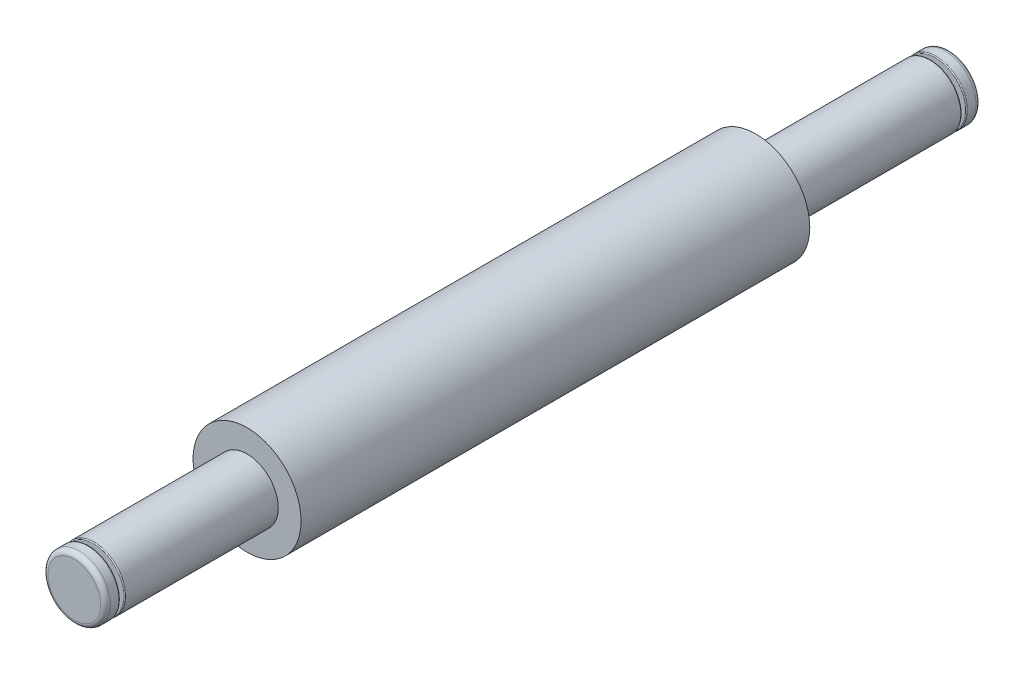
from build123d import *

# Parameters (mm, degrees)
SKETCH1_R                = 5.625
BOSS_EXTRUDE1_DEPTH      = 53
BOSS_EXTRUDE2_DEPTH      = 16
BOSS_EXTRUDE2_DEPTH_BACK = 71.2
SKETCH2_R                = 3.25
SKETCH3_R                = 1.75
BOSS_EXTRUDE3_DEPTH      = 0.5
BOSS_EXTRUDE4_START      = 0.5
SKETCH4_R                = 1.75
BOSS_EXTRUDE4_DEPTH      = 0.5
SKETCH5_R                = 3.25
BOSS_EXTRUDE5_DEPTH      = 1.5
BOSS_EXTRUDE6_START      = 1.5
SKETCH6_R                = 3.25
BOSS_EXTRUDE6_DEPTH      = 1.5
FILLET1_R                = 0.1
FILLET2_R                = 0.5


with BuildPart() as part:
    # Sketch1 → Boss-Extrude1 (new body)
    with BuildSketch(Plane.XY):
        with Locations((-222.185360959, 59.617346216)):
            Circle(SKETCH1_R)
    extrude(amount=-BOSS_EXTRUDE1_DEPTH)

    # Sketch2 → Boss-Extrude2 (add, two sides: drawn at the far end of the back side and taken through both)
    with BuildSketch(Plane.XY.offset(-BOSS_EXTRUDE2_DEPTH_BACK)):
        with Locations((-222.185360959, 59.617346216)):
            Circle(SKETCH2_R)
    extrude(amount=BOSS_EXTRUDE2_DEPTH + BOSS_EXTRUDE2_DEPTH_BACK)

    # Sketch3 → Boss-Extrude3 (add)
    with BuildSketch(Plane.XY.offset(16)):
        with Locations((-222.185360959, 59.617346216)):
            Circle(SKETCH3_R)
    extrude(amount=BOSS_EXTRUDE3_DEPTH)

    # Sketch4 → Boss-Extrude4 (add)
    with BuildSketch(Plane(origin=(0, 0, -71.2), x_dir=(-1, 0, 0), z_dir=(0, 0, -1)).offset(BOSS_EXTRUDE4_START)):
        with Locations(Location((222.185360959, 59.617346216, 0), (0, 0, 180))):
            Circle(SKETCH4_R)
    extrude(amount=-BOSS_EXTRUDE4_DEPTH)

    # Sketch5 → Boss-Extrude5 (add)
    with BuildSketch(Plane(origin=(0, 0, -71.7), x_dir=(-1, 0, 0), z_dir=(0, 0, -1))):
        with Locations(Location((222.185360959, 59.617346216, 0), (0, 0, 180))):
            Circle(SKETCH5_R)
    extrude(amount=BOSS_EXTRUDE5_DEPTH)

    # Sketch6 → Boss-Extrude6 (add)
    with BuildSketch(Plane.XY.offset(16.5).offset(BOSS_EXTRUDE6_START)):
        with Locations((-222.185360959, 59.617346216)):
            Circle(SKETCH6_R)
    extrude(amount=-BOSS_EXTRUDE6_DEPTH)

    # Fillet1
    fillet1_edges = [part.edges().sort_by_distance(p)[0] for p in [
        (-225.435360959, 59.617346216, -71.7),
        (-225.435360959, 59.617346216, 16.5),
        (-225.435360959, 59.617346216, -71.2),
        (-225.435360959, 59.617346216, 16),
    ]]
    fillet(fillet1_edges, radius=FILLET1_R)

    # Fillet2
    fillet2_edges = [part.edges().sort_by_distance(p)[0] for p in [
        (-225.435360959, 59.617346216, -73.2),
        (-225.435360959, 59.617346216, 18),
    ]]
    fillet(fillet2_edges, radius=FILLET2_R)


solid = part.part
